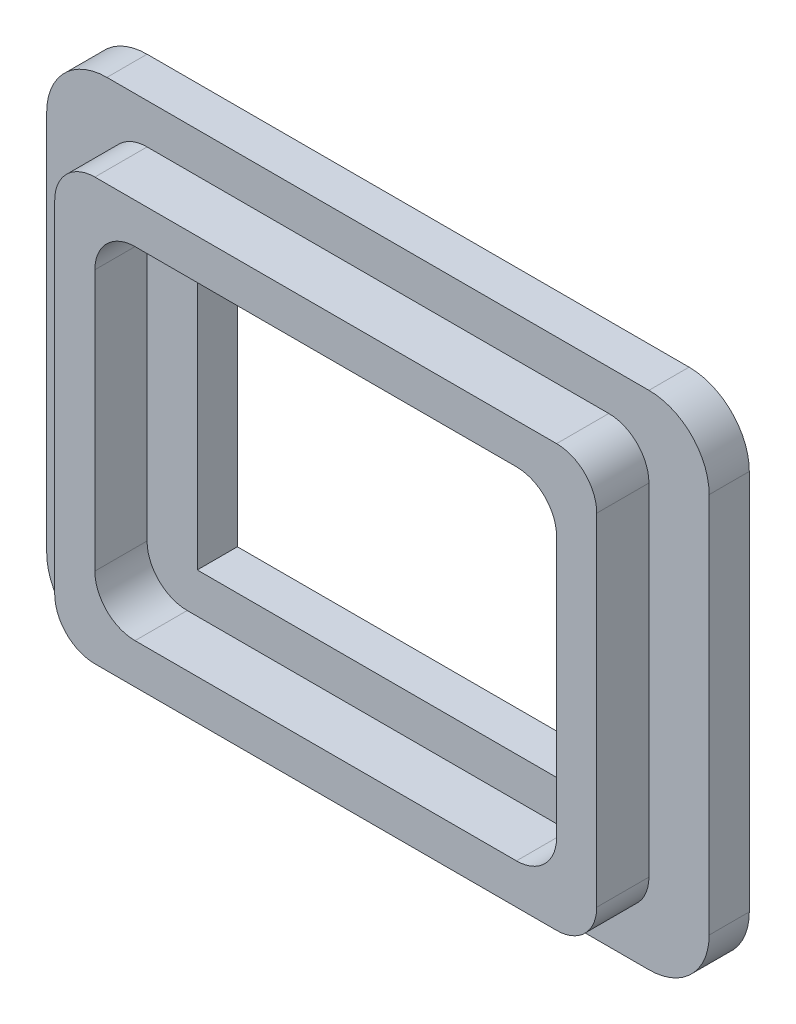
from build123d import *

# Parameters (mm, degrees)
Y_KSEKLIK_EKSTR_ZYON1_DEPTH = 2
Y_KSEKLIK_EKSTR_ZYON2_DEPTH = 2.6
IZIM3_W                     = 18
IZIM3_H                     = 13
KES_EKSTR_ZYON1_DEPTH       = 12


with BuildPart() as part:
    # Çizim1 → Yükseklik-Ekstrüzyon1 (new body)
    with BuildSketch(Plane.XY):
        with BuildLine():
            Line((-13.5, 12.5), (13.5, 12.5))
            ThreePointArc((13.5, 12.5), (15.621320344, 11.621320344), (16.5, 9.5))
            Line((16.5, 9.5), (16.5, -9.5))
            ThreePointArc((16.5, -9.5), (15.621320344, -11.621320344), (13.5, -12.5))
            Line((13.5, -12.5), (-13.5, -12.5))
            ThreePointArc((-13.5, -12.5), (-15.621320344, -11.621320344), (-16.5, -9.5))
            Line((-16.5, -9.5), (-16.5, 9.5))
            ThreePointArc((-16.5, 9.5), (-15.621320344, 11.621320344), (-13.5, 12.5))
        make_face()
    extrude(amount=Y_KSEKLIK_EKSTR_ZYON1_DEPTH)

    # Çizim2 → Yükseklik-Ekstrüzyon2 (add)
    with BuildSketch(Plane.XY.offset(2)):
        with BuildLine():
            Line((-11.5, 10.5), (11.5, 10.5))
            ThreePointArc((11.5, 10.5), (12.914213562, 9.914213562), (13.5, 8.5))
            Line((13.5, 8.5), (13.5, -8.5))
            ThreePointArc((13.5, -8.5), (12.914213562, -9.914213562), (11.5, -10.5))
            Line((11.5, -10.5), (-11.5, -10.5))
            ThreePointArc((-11.5, -10.5), (-12.914213562, -9.914213562), (-13.5, -8.5))
            Line((-13.5, -8.5), (-13.5, 8.5))
            ThreePointArc((-13.5, 8.5), (-12.914213562, 9.914213562), (-11.5, 10.5))
        make_face()
        with BuildLine():
            Line((-9.5, 8.5), (9.5, 8.5))
            ThreePointArc((9.5, 8.5), (10.914213562, 7.914213562), (11.5, 6.5))
            Line((11.5, 6.5), (11.5, -6.5))
            ThreePointArc((11.5, -6.5), (10.914213562, -7.914213562), (9.5, -8.5))
            Line((9.5, -8.5), (-9.5, -8.5))
            ThreePointArc((-9.5, -8.5), (-10.914213562, -7.914213562), (-11.5, -6.5))
            Line((-11.5, -6.5), (-11.5, 6.5))
            ThreePointArc((-11.5, 6.5), (-10.914213562, 7.914213562), (-9.5, 8.5))
        make_face(mode=Mode.SUBTRACT)
    extrude(amount=Y_KSEKLIK_EKSTR_ZYON2_DEPTH)

    # Çizim3 → Kes-Ekstrüzyon1 (cut)
    with BuildSketch(Plane.XY.offset(2)):
        Rectangle(IZIM3_W, IZIM3_H)
    extrude(amount=-KES_EKSTR_ZYON1_DEPTH, mode=Mode.SUBTRACT)


solid = part.part
